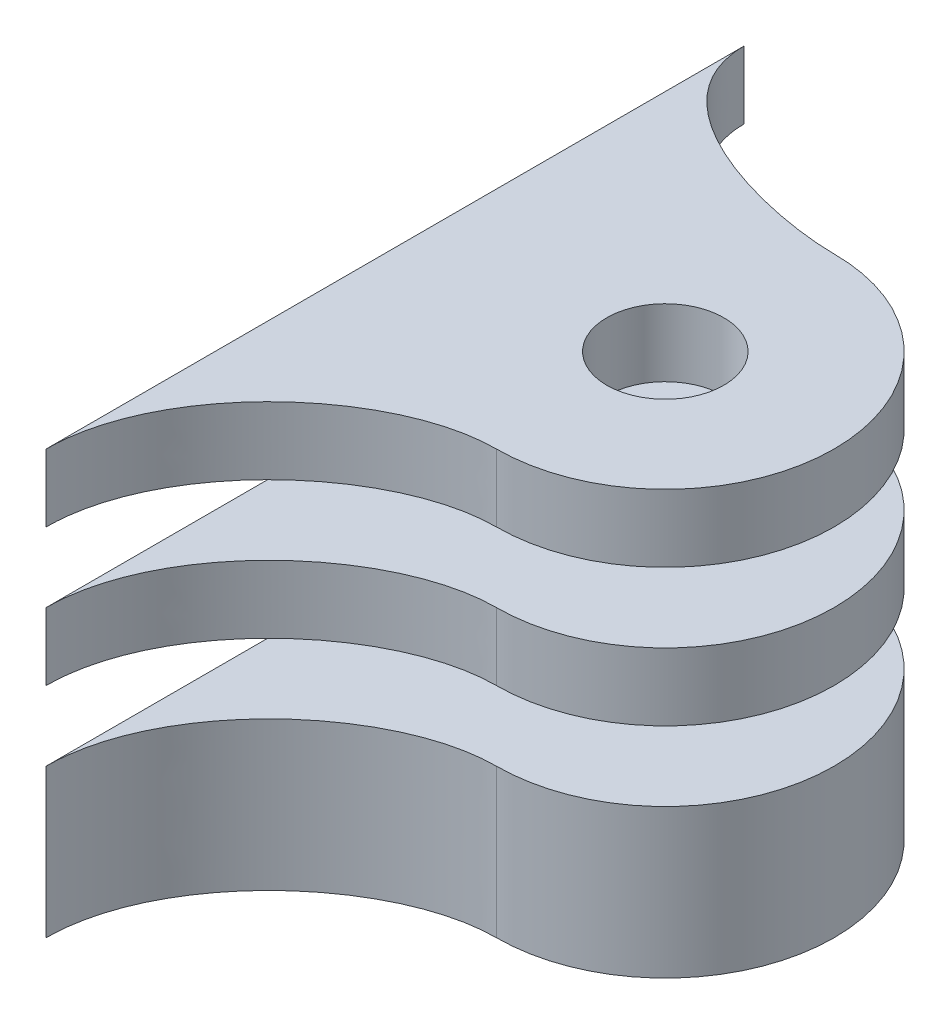
from build123d import *

# Parameters (mm, degrees)
SKETCH1_R           = 2.6
BOSS_EXTRUDE1_DEPTH = 3
SKETCH2_R           = 7.5
SKETCH2_R_2         = 2.6
BOSS_EXTRUDE2_DEPTH = 3
SKETCH3_R           = 7.5
SKETCH3_R_2         = 2.6
BOSS_EXTRUDE3_DEPTH = 3
BOSS_EXTRUDE4_DEPTH = 3.6


with BuildPart() as part:
    # Sketch1 → Boss-Extrude1 (new body)
    # profile 1 of 4: a face of its own
    with BuildSketch(Plane(origin=(0, 0, 0), x_dir=(1, 0, 0), z_dir=(0, 1, 0))):
        with BuildLine():
            ThreePointArc((0, -7.5), (-7.5, 0), (0, 7.5))
            Line((0, 7.5), (-10, 7.5))
            Line((-10, 7.5), (-10, -7.5))
            Line((-10, -7.5), (0, -7.5))
        make_face()
    # profile 2 of 4: a face of its own
    with BuildSketch(Plane(origin=(0, 0, 0), x_dir=(1, 0, 0), z_dir=(0, 1, 0))):
        with BuildLine():
            ThreePointArc((7.5, 0), (5.303300859, 5.303300859), (0, 7.5))
            ThreePointArc((0, 7.5), (-7.5, 0), (0, -7.5))
            ThreePointArc((0, -7.5), (5.303300859, -5.303300859), (7.5, 0))
        make_face()
        with Locations(Location((0, 0, 0), (0, 0, 270))):
            Circle(SKETCH1_R, mode=Mode.SUBTRACT)
    # profile 3 of 4: a face of its own
    with BuildSketch(Plane(origin=(0, 0, 0), x_dir=(1, 0, 0), z_dir=(0, 1, 0))):
        with BuildLine():
            Line((-10, 7.5), (0, 7.5))
            add(Edge.make_bspline(
                [(0, 7.5), (-2.81326337, 7.5), (-10, 9.040913294), (-10, 13.5)],
                knots=[0, 0, 0, 0, 1, 1, 1, 1], degree=3))
            Line((-10, 13.5), (-10, 7.5))
        make_face()
    # profile 4 of 4: a face of its own
    with BuildSketch(Plane(origin=(0, 0, 0), x_dir=(1, 0, 0), z_dir=(0, 1, 0))):
        with BuildLine():
            add(Edge.make_bspline(
                [(0, -7.5), (-4.572694464, -7.5), (-10, -12.37583285), (-10, -17.5)],
                knots=[0, 0, 0, 0, 1, 1, 1, 1], degree=3))
            Line((0, -7.5), (-10, -7.5))
            Line((-10, -7.5), (-10, -17.5))
        make_face()
    extrude(amount=-BOSS_EXTRUDE1_DEPTH)

    # Sketch4 → Boss-Extrude4 (add)
    # profile 1 of 4: a face of its own
    with BuildSketch(Plane.XZ.offset(3)):
        with BuildLine():
            add(Edge.make_bspline(
                [(0, -7.5), (-2.81326337, -7.5), (-10, -9.040913294), (-10, -13.5)],
                knots=[0, 0, 0, 0, 1, 1, 1, 1], degree=3))
            Line((0, -7.5), (-10, -7.5))
            Line((-10, -7.5), (-10, -13.5))
        make_face()
    # profile 2 of 4: a face of its own
    with BuildSketch(Plane.XZ.offset(3)):
        with BuildLine():
            Line((-10, -7.5), (0, -7.5))
            ThreePointArc((0, -7.5), (-7.5, 0), (0, 7.5))
            Line((0, 7.5), (-10, 7.5))
            Line((-10, 7.5), (-10, -7.5))
        make_face()
    # profile 3 of 4: a face of its own
    with BuildSketch(Plane.XZ.offset(3)):
        with BuildLine():
            ThreePointArc((0, 7.5), (-7.5, 0), (0, -7.5))
            ThreePointArc((0, -7.5), (5.303300859, -5.303300859), (7.5, 0))
            ThreePointArc((7.5, 0), (5.303300859, 5.303300859), (0, 7.5))
        make_face()
        Polygon((0, 4.67653718), (4.05, 2.33826859), (4.05, -2.33826859), (0, -4.67653718), (-4.05, -2.33826859), (-4.05, 2.33826859), align=None, mode=Mode.SUBTRACT)
    # profile 4 of 4: a face of its own
    with BuildSketch(Plane.XZ.offset(3)):
        with BuildLine():
            Line((-10, 7.5), (0, 7.5))
            add(Edge.make_bspline(
                [(0, 7.5), (-4.572694464, 7.5), (-10, 12.37583285), (-10, 17.5)],
                knots=[0, 0, 0, 0, 1, 1, 1, 1], degree=3))
            Line((-10, 17.5), (-10, 7.5))
        make_face()
    extrude(amount=BOSS_EXTRUDE4_DEPTH)


with BuildPart() as body_2:
    # Sketch2 → Boss-Extrude2 (new body)
    # profile 1 of 4: a face of its own
    with BuildSketch(Plane(origin=(0, 3.1, 0), x_dir=(1, 0, 0), z_dir=(0, 1, 0))):
        with BuildLine():
            ThreePointArc((0, -7.5), (-7.5, 0), (0, 7.5))
            Line((0, 7.5), (-10, 7.5))
            Line((-10, 7.5), (-10, -7.5))
            Line((-10, -7.5), (0, -7.5))
        make_face()
    # profile 2 of 4: a face of its own
    with BuildSketch(Plane(origin=(0, 3.1, 0), x_dir=(1, 0, 0), z_dir=(0, 1, 0))):
        Circle(SKETCH2_R)
        with Locations(Location((0, 0, 0), (0, 0, 270))):
            Circle(SKETCH2_R_2, mode=Mode.SUBTRACT)
    # profile 3 of 4: a face of its own
    with BuildSketch(Plane(origin=(0, 3.1, 0), x_dir=(1, 0, 0), z_dir=(0, 1, 0))):
        with BuildLine():
            add(Edge.make_bspline(
                [(0, -7.5), (-4.572694464, -7.5), (-10, -12.37583285), (-10, -17.5)],
                knots=[0, 0, 0, 0, 1, 1, 1, 1], degree=3))
            Line((-10, -17.5), (-10, -7.5))
            Line((-10, -7.5), (0, -7.5))
        make_face()
    # profile 4 of 4: a face of its own
    with BuildSketch(Plane(origin=(0, 3.1, 0), x_dir=(1, 0, 0), z_dir=(0, 1, 0))):
        with BuildLine():
            Line((0, 7.5), (-10, 7.5))
            Line((-10, 7.5), (-10, 13.5))
            add(Edge.make_bspline(
                [(0, 7.5), (-2.81326337, 7.5), (-10, 9.040913294), (-10, 13.5)],
                knots=[0, 0, 0, 0, 1, 1, 1, 1], degree=3))
        make_face()
    extrude(amount=BOSS_EXTRUDE2_DEPTH)


with BuildPart() as body_3:
    # Sketch3 → Boss-Extrude3 (new body)
    # profile 1 of 4: a face of its own
    with BuildSketch(Plane(origin=(0, 9.2, 0), x_dir=(1, 0, 0), z_dir=(0, 1, 0))):
        with BuildLine():
            ThreePointArc((0, -7.5), (-7.5, 0), (0, 7.5))
            Line((0, 7.5), (-10, 7.5))
            Line((-10, 7.5), (-10, -7.5))
            Line((-10, -7.5), (0, -7.5))
        make_face()
    # profile 2 of 4: a face of its own
    with BuildSketch(Plane(origin=(0, 9.2, 0), x_dir=(1, 0, 0), z_dir=(0, 1, 0))):
        Circle(SKETCH3_R)
        with Locations(Location((0, 0, 0), (0, 0, 270))):
            Circle(SKETCH3_R_2, mode=Mode.SUBTRACT)
    # profile 3 of 4: a face of its own
    with BuildSketch(Plane(origin=(0, 9.2, 0), x_dir=(1, 0, 0), z_dir=(0, 1, 0))):
        with BuildLine():
            add(Edge.make_bspline(
                [(0, -7.5), (-4.572694464, -7.5), (-10, -12.37583285), (-10, -17.5)],
                knots=[0, 0, 0, 0, 1, 1, 1, 1], degree=3))
            Line((-10, -17.5), (-10, -7.5))
            Line((-10, -7.5), (0, -7.5))
        make_face()
    # profile 4 of 4: a face of its own
    with BuildSketch(Plane(origin=(0, 9.2, 0), x_dir=(1, 0, 0), z_dir=(0, 1, 0))):
        with BuildLine():
            Line((0, 7.5), (-10, 7.5))
            Line((-10, 7.5), (-10, 13.5))
            add(Edge.make_bspline(
                [(0, 7.5), (-2.81326337, 7.5), (-10, 9.040913294), (-10, 13.5)],
                knots=[0, 0, 0, 0, 1, 1, 1, 1], degree=3))
        make_face()
    extrude(amount=BOSS_EXTRUDE3_DEPTH)


solid = Compound([part.part, body_2.part, body_3.part])
